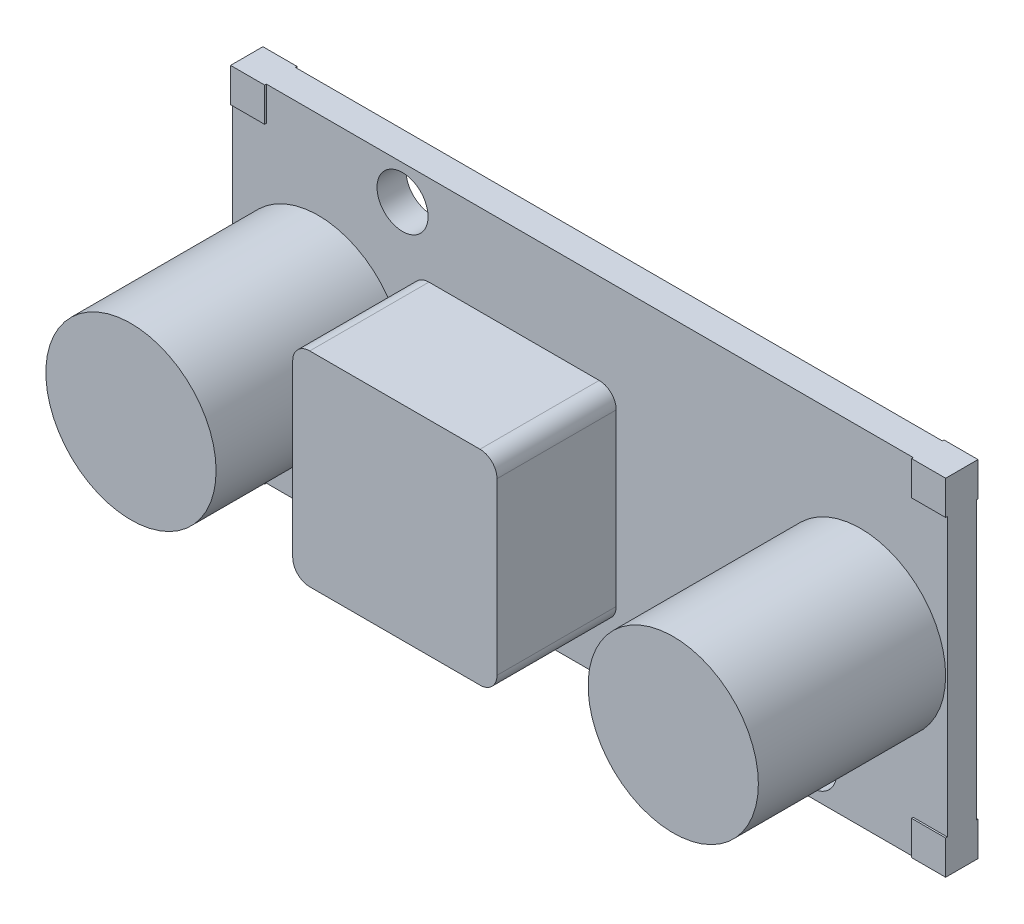
from build123d import *

# Parameters (mm, degrees)
SKETCH1_W           = 42
SKETCH1_H           = 20.3
BOSS_EXTRUDE1_DEPTH = 1.7
BOSS_EXTRUDE2_START = 1.7
SKETCH1_3_R         = 5
BOSS_EXTRUDE2_DEPTH = 11
BOSS_EXTRUDE3_START = 1.7
SKETCH1_4_W         = 12
SKETCH1_4_H         = 12
BOSS_EXTRUDE3_DEPTH = 7
FILLET1_R           = 1
SKETCH1_5_R         = 1.5
CUT_EXTRUDE1_DEPTH  = 27.557720158
BOSS_EXTRUDE4_START = -0.1
SKETCH1_6_W         = 2
SKETCH1_6_H         = 2
BOSS_EXTRUDE4_DEPTH = 1.9


with BuildPart() as part:
    # Sketch1 → Boss-Extrude1 (new body)
    with BuildSketch(Plane.XY):
        Rectangle(SKETCH1_W, SKETCH1_H)
    extrude(amount=BOSS_EXTRUDE1_DEPTH)

    # Sketch1<3> → Boss-Extrude2 (add)
    with BuildSketch(Plane.XY.offset(BOSS_EXTRUDE2_START)):
        with Locations((-15.95, 0)):
            Circle(SKETCH1_3_R)
        with Locations((15.9, 0)):
            Circle(SKETCH1_3_R)
    extrude(amount=BOSS_EXTRUDE2_DEPTH)

    # Sketch1<4> → Boss-Extrude3 (add)
    with BuildSketch(Plane.XY.offset(BOSS_EXTRUDE3_START)):
        with Locations((-4.45, -1.15)):
            Rectangle(SKETCH1_4_W, SKETCH1_4_H)
    extrude(amount=BOSS_EXTRUDE3_DEPTH)

    # Fillet1
    fillet1_edges = [part.edges().sort_by_distance(p)[0] for p in [
        (-10.45, 4.85, 5.2),
        (-10.45, -7.15, 5.2),
        (1.55, -7.15, 5.2),
        (1.55, 4.85, 5.2),
    ]]
    fillet(fillet1_edges, radius=FILLET1_R)

    # Sketch1<5> → Cut-Extrude1 (cut, through all)
    with BuildSketch(Plane.XY):
        with Locations((-11, 8.15)):
            Circle(SKETCH1_5_R)
        with Locations((13, -8.15)):
            Circle(SKETCH1_5_R)
    extrude(amount=CUT_EXTRUDE1_DEPTH, mode=Mode.SUBTRACT)

    # Sketch1<6> → Boss-Extrude4 (add)
    with BuildSketch(Plane.XY.offset(BOSS_EXTRUDE4_START)):
        with Locations((20, 9.15)):
            Rectangle(SKETCH1_6_W, SKETCH1_6_H)
        with Locations((-20, 9.15)):
            Rectangle(SKETCH1_6_W, SKETCH1_6_H)
        with Locations((20, -9.15)):
            Rectangle(SKETCH1_6_W, SKETCH1_6_H)
        with Locations((-20, -9.15)):
            Rectangle(SKETCH1_6_W, SKETCH1_6_H)
    extrude(amount=BOSS_EXTRUDE4_DEPTH)


solid = part.part
